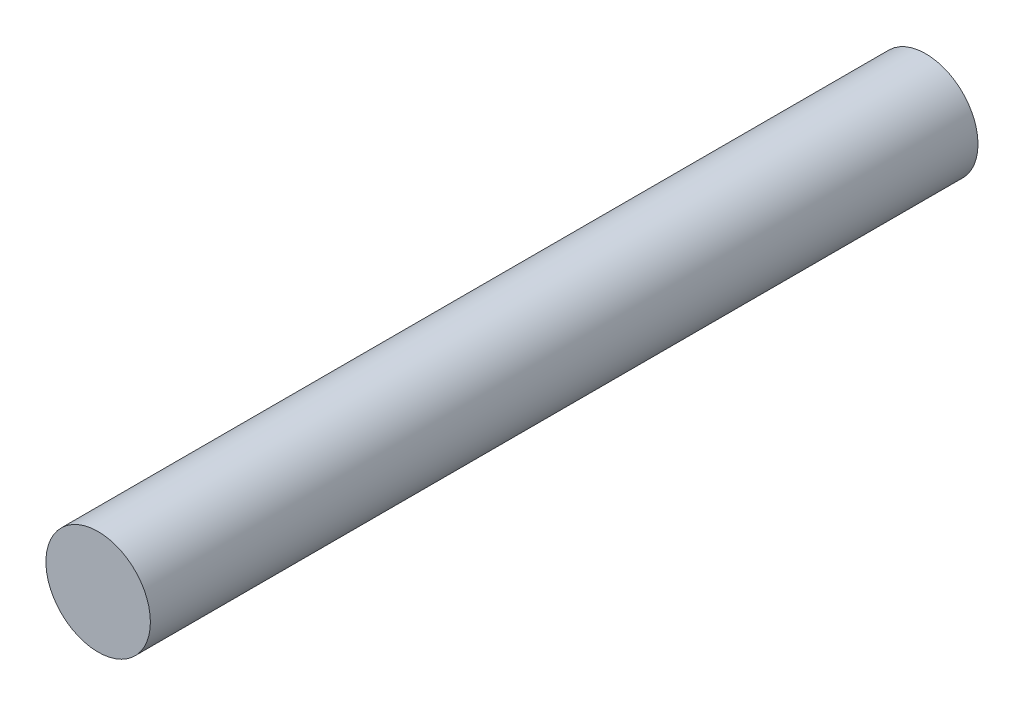
from build123d import *

# Parameters (mm, degrees)
SKETCH1_R           = 0.6477
BOSS_EXTRUDE1_DEPTH = 10.2616


with BuildPart() as part:
    # Sketch1 → Boss-Extrude1 (new body)
    with BuildSketch(Plane.XY):
        Circle(SKETCH1_R)
    extrude(amount=BOSS_EXTRUDE1_DEPTH)


solid = part.part
